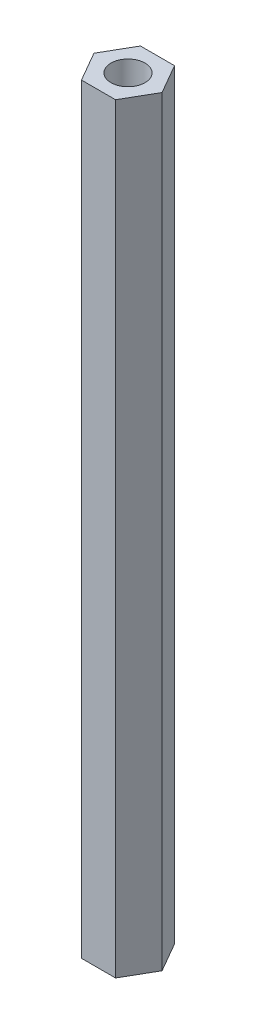
from build123d import *

# Parameters (mm, degrees)
SKETCH_1_R      = 1.5
EXTRUDE_1_DEPTH = 67


with BuildPart() as part:
    # 草图1 → 凸台-拉伸1 (new body)
    with BuildSketch(Plane(origin=(0, 0, 0), x_dir=(1, 0, 0), z_dir=(0, 1, 0))):
        Polygon((3, 0), (1.5, 2.598076211), (-1.5, 2.598076211), (-3, 0), (-1.5, -2.598076211), (1.5, -2.598076211), align=None)
        with Locations(Location((0, 0, 0), (0, 0, 270))):
            Circle(SKETCH_1_R, mode=Mode.SUBTRACT)
    extrude(amount=EXTRUDE_1_DEPTH)


solid = part.part
